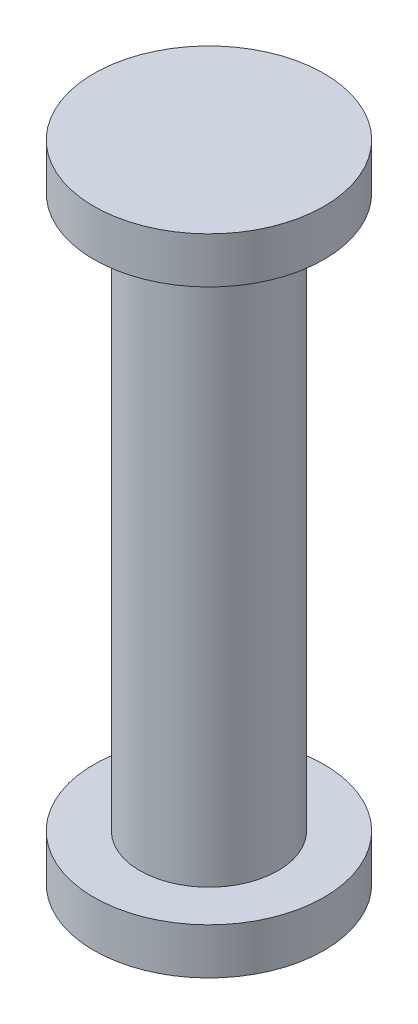
from build123d import *


with BuildPart() as part:
    # Sketch1 → Revolve1 (revolve)
    with BuildSketch(Plane.XY, mode=Mode.PRIVATE) as revolve1_sk:
        Polygon((0, 0), (0, 14), (-2.5, 14), (-2.5, 13), (-1.5, 13), (-1.5, 1), (-2.5, 1), (-2.5, 0), align=None)
    revolve(revolve1_sk.sketch.rotate(Axis((0, 0, 0), (0, 1, 0)), 180), axis=Axis((0, 0, 0), (0, 1, 0)))


solid = part.part
